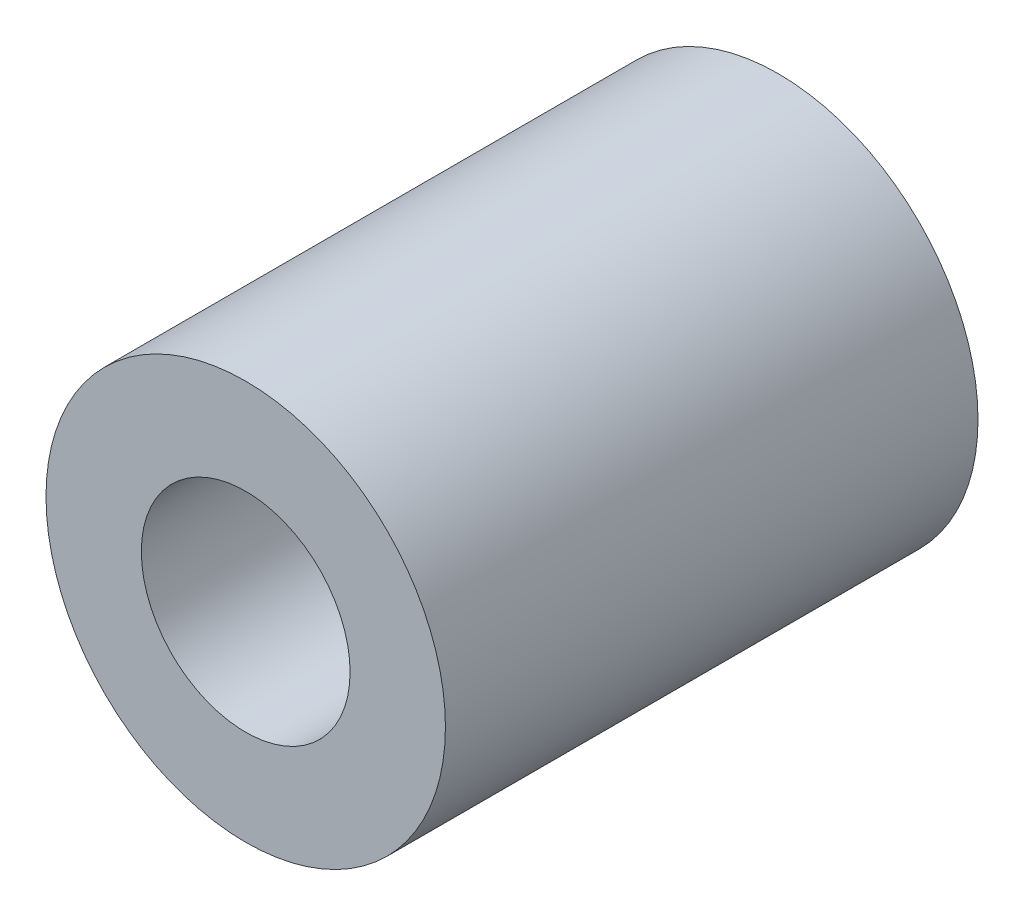
from build123d import *

# Parameters (mm, degrees)
SKETCH1_R           = 4.7625
SKETCH1_R_2         = 2.4892
BOSS_EXTRUDE1_DEPTH = 6.35


with BuildPart() as part:
    # Sketch1 → Boss-Extrude1 (new, symmetric)
    with BuildSketch(Plane.XY):
        Circle(SKETCH1_R)
        Circle(SKETCH1_R_2, mode=Mode.SUBTRACT)
    extrude(amount=BOSS_EXTRUDE1_DEPTH, both=True)


solid = part.part
